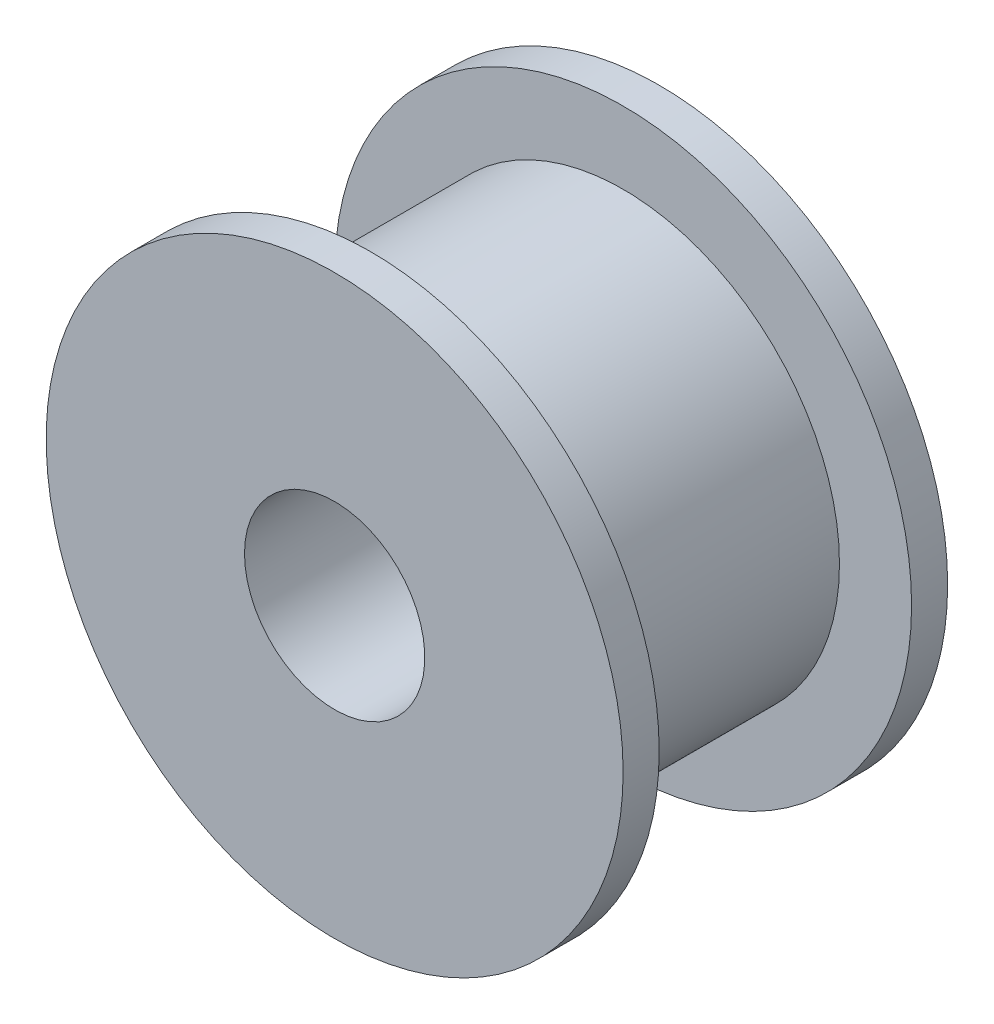
from build123d import *

# Parameters (mm, degrees)
SKETCH3_R           = 8
BOSS_EXTRUDE1_DEPTH = 4.5
SKETCH4_R           = 2.5
CUT_EXTRUDE1_DEPTH  = 15.456832295
SKETCH6_R           = 8
SKETCH6_R_2         = 6
CUT_EXTRUDE2_DEPTH  = 3.5


with BuildPart() as part:
    # Sketch3 → Boss-Extrude1 (new, symmetric)
    with BuildSketch(Plane.XY):
        Circle(SKETCH3_R)
    extrude(amount=BOSS_EXTRUDE1_DEPTH, both=True)

    # Sketch4 → Cut-Extrude1 (cut, through all)
    with BuildSketch(Plane(origin=(0, 0, -4.5), x_dir=(-1, 0, 0), z_dir=(0, 0, -1))):
        Circle(SKETCH4_R)
    extrude(amount=-CUT_EXTRUDE1_DEPTH, mode=Mode.SUBTRACT)

    # Sketch6 → Cut-Extrude2 (cut, symmetric)
    with BuildSketch(Plane.XY):
        Circle(SKETCH6_R)
        Circle(SKETCH6_R_2, mode=Mode.SUBTRACT)
    extrude(amount=CUT_EXTRUDE2_DEPTH, both=True, mode=Mode.SUBTRACT)


solid = part.part
